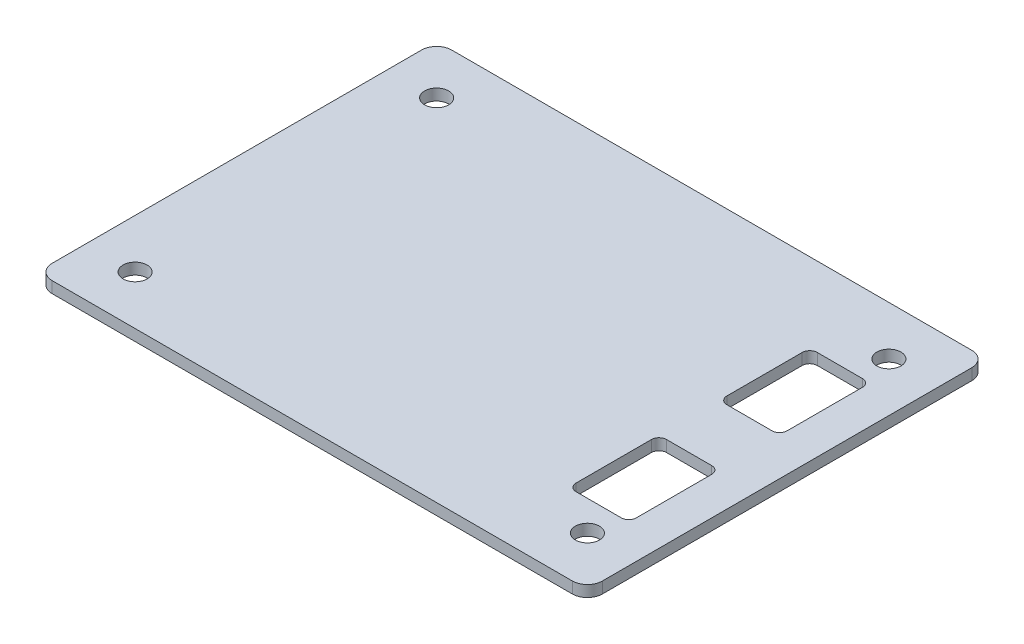
from build123d import *

# Parameters (mm, degrees)
SKETCH_1_W                     = 73
SKETCH_1_H                     = 53
EXTRUDE_1_DEPTH                = 1.5
FILLET_1_R                     = 2
SKETCH_2_R                     = 1.6
CUT_EXTRUDE_1_DEPTH            = 46.130366717
PATTERN_LINEAR_1_COUNT         = 2
PATTERN_LINEAR_1_PITCH         = 60
PATTERN_LINEAR_1_COUNT_DIR2    = 2
PATTERN_LINEAR_1_PITCH_DIR2    = 40
SKETCH_3_W                     = 8
SKETCH_3_H                     = 12
CUT_EXTRUDE_2_DEPTH            = 46.130366717
FILLET_2_R                     = 1
PATTERN_LINEAR_2_COUNT         = 2
PATTERN_LINEAR_2_PITCH         = 20
FILLET_2_OF_PATTERN_LINEAR_2_R = 1


with BuildPart() as part:
    # 草图1 → 凸台-拉伸1 (new body)
    with BuildSketch(Plane(origin=(0, 0, 0), x_dir=(1, 0, 0), z_dir=(0, 1, 0))):
        Rectangle(SKETCH_1_W, SKETCH_1_H)
    extrude(amount=EXTRUDE_1_DEPTH)

    # 圆角1
    fillet_1_edges = [part.edges().sort_by_distance(p)[0] for p in [
        (-36.5, 0.75, -26.5),
        (36.5, 0.75, -26.5),
        (36.5, 0.75, 26.5),
        (-36.5, 0.75, 26.5),
    ]]
    fillet(fillet_1_edges, radius=FILLET_1_R)

    # 草图2 → 切除-拉伸1 (cut, through all)
    with BuildSketch(Plane(origin=(0, 1.5, 0), x_dir=(1, 0, 0), z_dir=(0, 1, 0))):
        with Locations(Location((-30, 20, 0), (0, 0, 270))):
            Circle(SKETCH_2_R)
    cut_extrude_1 = extrude(amount=-CUT_EXTRUDE_1_DEPTH, mode=Mode.SUBTRACT)

    # 阵列(线性)1: Cut-Extrude 1 2 × 2
    with Locations(*[(i * PATTERN_LINEAR_1_PITCH, 0, j * PATTERN_LINEAR_1_PITCH_DIR2) for i in range(PATTERN_LINEAR_1_COUNT) for j in range(PATTERN_LINEAR_1_COUNT_DIR2) if (i, j) != (0, 0)]):
        add(cut_extrude_1, mode=Mode.SUBTRACT)

    # 草图3 → 切除-拉伸2 (cut, through all)
    with BuildSketch(Plane(origin=(0, 1.5, 0), x_dir=(1, 0, 0), z_dir=(0, 1, 0))):
        with Locations((27.5, 10)):
            Rectangle(SKETCH_3_W, SKETCH_3_H)
    cut_extrude_2 = extrude(amount=-CUT_EXTRUDE_2_DEPTH, mode=Mode.SUBTRACT)

    # 圆角2
    fillet_2_edges = [part.edges().sort_by_distance(p)[0] for p in [
        (23.5, 0.75, -4),
        (23.5, 0.75, -16),
        (31.5, 0.75, -16),
        (31.5, 0.75, -4),
    ]]
    fillet(fillet_2_edges, radius=FILLET_2_R)

    # 阵列(线性)2: 切除-拉伸2 ×2
    with Locations(*[(0, 0, i * PATTERN_LINEAR_2_PITCH) for i in range(1, PATTERN_LINEAR_2_COUNT)]):
        add(cut_extrude_2, mode=Mode.SUBTRACT)

    # 圆角2 of 阵列(线性)2
    fillet_2_of_pattern_linear_2_edges = [part.edges().sort_by_distance(p)[0] for p in [
        (23.5, 0.75, 16),
        (23.5, 0.75, 4),
        (31.5, 0.75, 4),
        (31.5, 0.75, 16),
    ]]
    fillet(fillet_2_of_pattern_linear_2_edges, radius=FILLET_2_OF_PATTERN_LINEAR_2_R)


solid = part.part
